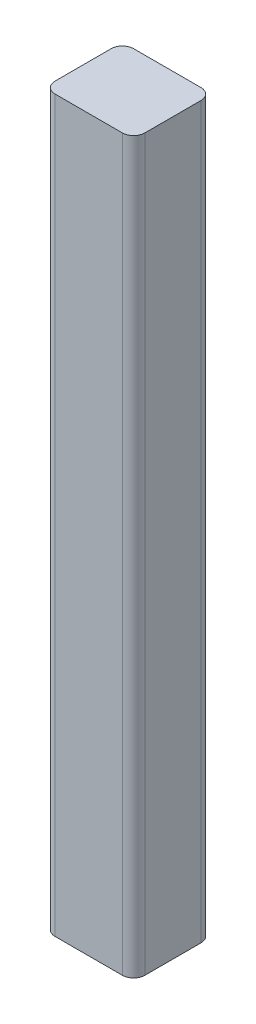
from build123d import *

# Parameters (mm, degrees)
SKETCH1_W           = 8
SKETCH1_H           = 7
BOSS_EXTRUDE1_DEPTH = 65
FILLET1_R           = 1


with BuildPart() as part:
    # Sketch1 → Boss-Extrude1 (new body)
    with BuildSketch(Plane(origin=(0, 0, 0), x_dir=(1, 0, 0), z_dir=(0, 1, 0))):
        Rectangle(SKETCH1_W, SKETCH1_H)
    extrude(amount=BOSS_EXTRUDE1_DEPTH)

    # Fillet1
    fillet1_edges = [part.edges().sort_by_distance(p)[0] for p in [
        (4, 32.5, 3.5),
        (-4, 32.5, 3.5),
        (-4, 32.5, -3.5),
        (4, 32.5, -3.5),
    ]]
    fillet(fillet1_edges, radius=FILLET1_R)


solid = part.part
